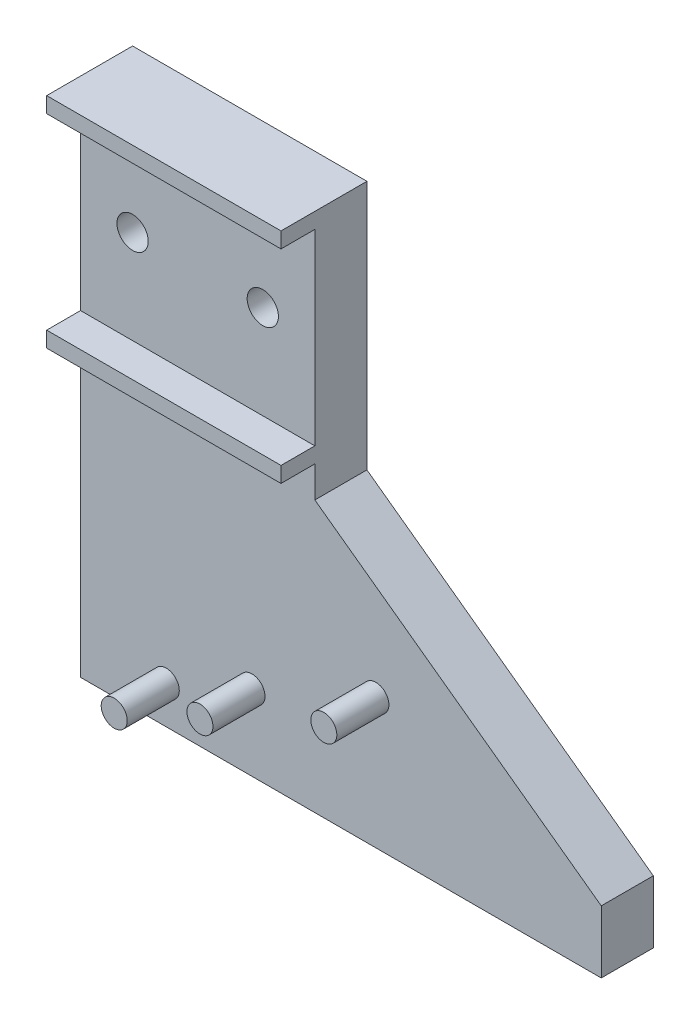
from build123d import *

# Parameters (mm, degrees)
BOSS_EXTRUDE1_DEPTH = 10
SKETCH3_W           = 45
SKETCH3_H           = 3
BOSS_EXTRUDE2_DEPTH = 6.5
SKETCH4_R           = 3
CUT_EXTRUDE2_DEPTH  = 10
SKETCH5_R           = 2.5
BOSS_EXTRUDE3_DEPTH = 10


with BuildPart() as part:
    # Sketch2 → Boss-Extrude1 (new body)
    with BuildSketch(Plane.XY):
        Polygon((0, 0), (100, 0), (100, 12), (45, 52), (45, 100), (0, 100), align=None)
    extrude(amount=-BOSS_EXTRUDE1_DEPTH)

    # Sketch3 → Boss-Extrude2 (add)
    with BuildSketch(Plane.XY):
        with Locations((22.5, 98.5)):
            Rectangle(SKETCH3_W, SKETCH3_H)
        with Locations((22.5, 59.5)):
            Rectangle(SKETCH3_W, SKETCH3_H)
    extrude(amount=BOSS_EXTRUDE2_DEPTH)

    # Sketch4 → Cut-Extrude2 (cut)
    with BuildSketch(Plane.XY):
        with Locations((10, 79)):
            Circle(SKETCH4_R)
        with Locations((35, 79)):
            Circle(SKETCH4_R)
    extrude(amount=-CUT_EXTRUDE2_DEPTH, mode=Mode.SUBTRACT)

    # Sketch5 → Boss-Extrude3 (add)
    with BuildSketch(Plane.XY):
        with Locations((16.467286656, 7.268319627)):
            Circle(SKETCH5_R)
        with Locations((32.934573311, 14.536639255)):
            Circle(SKETCH5_R)
        with Locations((56.720654036, 25.035323161)):
            Circle(SKETCH5_R)
    extrude(amount=BOSS_EXTRUDE3_DEPTH)


solid = part.part
